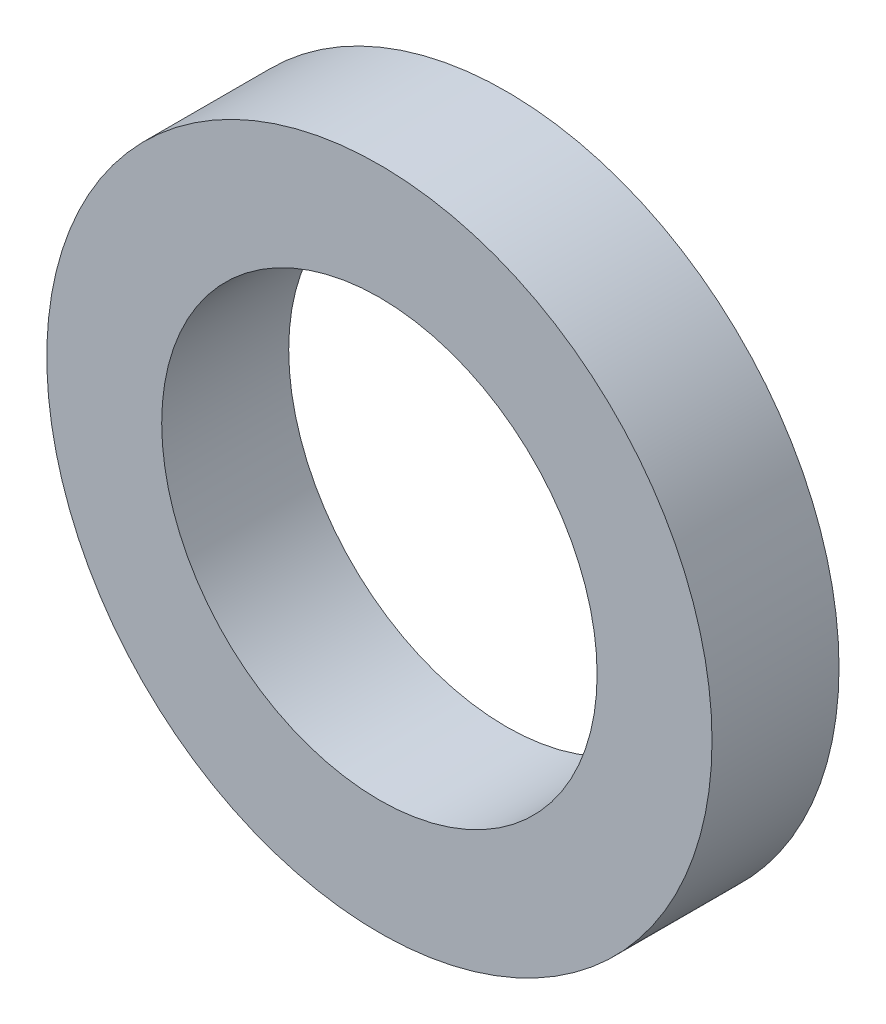
from build123d import *

# Parameters (mm, degrees)
SKETCH1_R           = 13.97
SKETCH1_R_2         = 9.144
BOSS_EXTRUDE1_DEPTH = 2.667


with BuildPart() as part:
    # Sketch1 → Boss-Extrude1 (new, symmetric)
    with BuildSketch(Plane.XY):
        Circle(SKETCH1_R)
        Circle(SKETCH1_R_2, mode=Mode.SUBTRACT)
    extrude(amount=BOSS_EXTRUDE1_DEPTH, both=True)


solid = part.part
